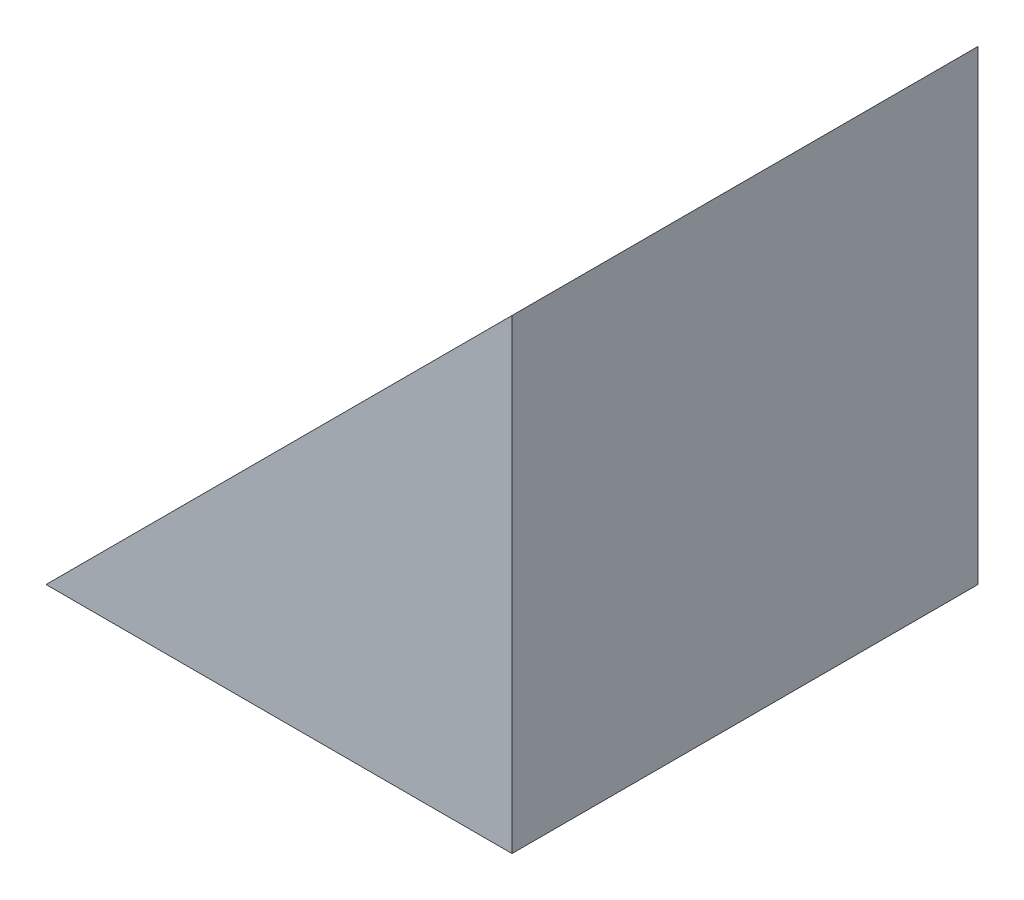
from build123d import *

# Parameters (mm, degrees)
BOSS_EXTRUDE1_DEPTH = 2


with BuildPart() as part:
    # Sketch1 → Boss-Extrude1 (new body)
    with BuildSketch(Plane.XY):
        Polygon((1, 1), (-1, -1), (1, -1), align=None)
    extrude(amount=BOSS_EXTRUDE1_DEPTH)


solid = part.part
